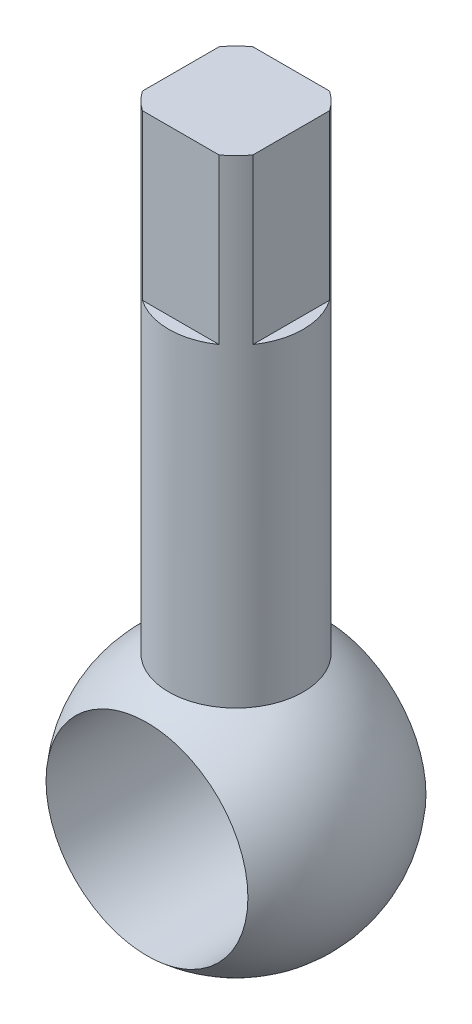
from build123d import *

# Parameters (mm, degrees)
CORTAR_EXTRUIR1_DEPTH      = 143.277187996
CORTAR_EXTRUIR1_DEPTH_BACK = 143.277187996
CROQUIS2_R                 = 19.05
CROQUIS3_W                 = 14.478
CROQUIS3_H                 = 4.572
CORTAR_EXTRUIR2_DEPTH      = 30.988
MATRIZC1_COUNT             = 4


with BuildPart() as part:
    # Croquis1 → Revolución1 (revolve)
    with BuildSketch(Plane.XY):
        with BuildLine():
            Line((0, 0), (0, 137.668))
            Line((0, 137.668), (-12.7, 137.668))
            Line((-12.7, 137.668), (-12.7, 47.397045256))
            ThreePointArc((-12.7, 47.397045256), (-24.534515988, 18.825996254), (0, 0))
        make_face()
    revolve(axis=Axis((0, 0, 0), (0, 1, 0)))

    # Croquis2 → Cortar-Extruir1 (cut, two sides: drawn at the far end of the back side and taken through both)
    with BuildSketch(Plane.XY.offset(-CORTAR_EXTRUIR1_DEPTH_BACK)):
        with Locations((0, 25.4)):
            Circle(CROQUIS2_R)
    extrude(amount=CORTAR_EXTRUIR1_DEPTH + CORTAR_EXTRUIR1_DEPTH_BACK, mode=Mode.SUBTRACT)

    # Croquis3 → Cortar-Extruir2 (cut)
    with BuildSketch(Plane(origin=(0, 137.668, 0), x_dir=(1, 0, 0), z_dir=(0, 1, 0))):
        with Locations((0, 12.720887589)):
            Rectangle(CROQUIS3_W, CROQUIS3_H)
    cortar_extruir2 = extrude(amount=-CORTAR_EXTRUIR2_DEPTH, mode=Mode.SUBTRACT)

    # MatrizC1: Cortar-Extruir2 ×4 about axis
    matrizc1_axis = Axis((0, 0, 0), (0, 1, 0))
    for i in range(1, MATRIZC1_COUNT):
        add(cortar_extruir2.rotate(matrizc1_axis, i * 360 / MATRIZC1_COUNT), mode=Mode.SUBTRACT)


solid = part.part
